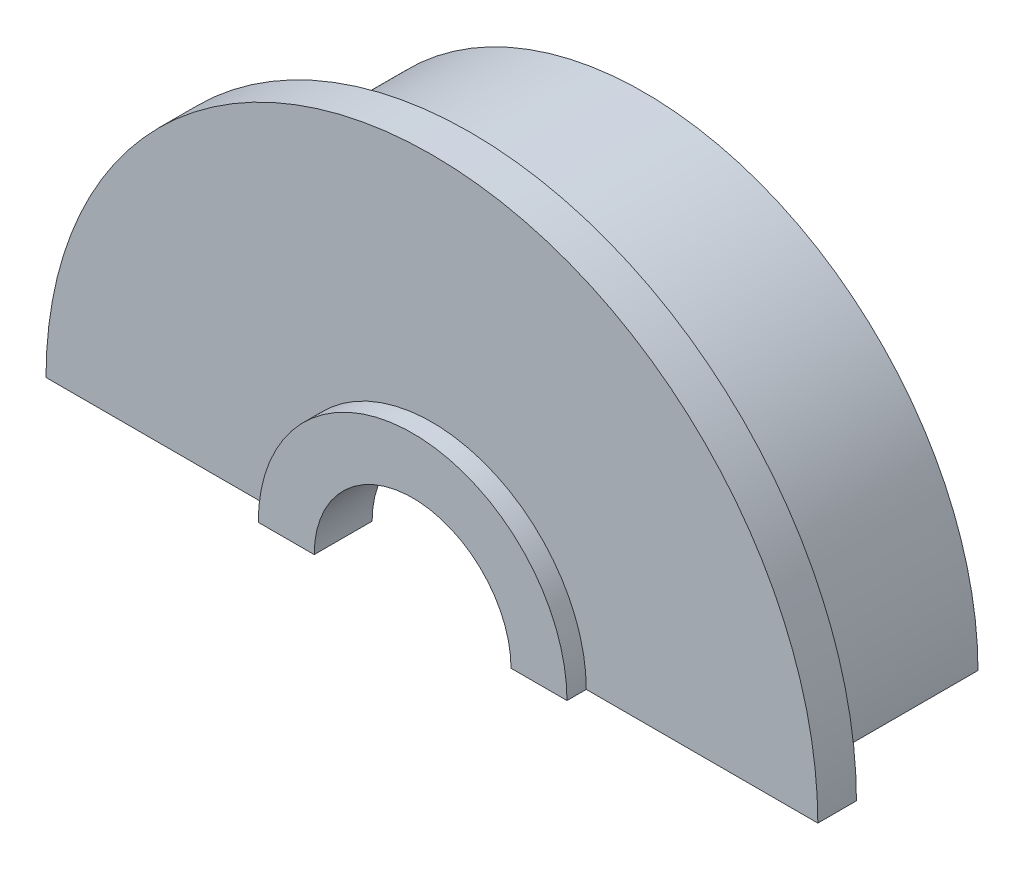
from build123d import *

# Parameters (mm, degrees)
SKETCH1_R               = 17.3
BOSS_EXTRUDE1_DEPTH     = 9
SKETCH2_R               = 5.1
CUT_EXTRUDE1_DEPTH      = 10
SKETCH3_R               = 8.125
CUT_EXTRUDE2_DEPTH      = 9
SKETCH4_R               = 20
SKETCH4_R_2             = 5.1
BOSS_EXTRUDE2_DEPTH     = 2
CUT_EXTRUDE3_DEPTH      = 31.347981811
CUT_EXTRUDE3_DEPTH_BACK = 31.347981811
SKETCH5_W               = 52.021349681
SKETCH5_H               = 22.661429066
BOSS_EXTRUDE3_DEPTH     = 1
SKETCH8_R               = 10.75
CUT_EXTRUDE4_DEPTH      = 3


with BuildPart() as part:
    # Sketch1 → Boss-Extrude1 (new body)
    with BuildSketch(Plane.XY):
        Circle(SKETCH1_R)
    extrude(amount=BOSS_EXTRUDE1_DEPTH)

    # Sketch2 → Cut-Extrude1 (cut)
    with BuildSketch(Plane.XY.offset(9)):
        Circle(SKETCH2_R)
    extrude(amount=-CUT_EXTRUDE1_DEPTH, mode=Mode.SUBTRACT)

    # Sketch3 → Cut-Extrude2 (cut)
    with BuildSketch(Plane(origin=(0, 0, 0), x_dir=(-1, 0, 0), z_dir=(0, 0, -1))):
        Circle(SKETCH3_R)
    extrude(amount=-CUT_EXTRUDE2_DEPTH, mode=Mode.SUBTRACT)

    # Sketch4 → Boss-Extrude2 (add)
    with BuildSketch(Plane.XY.offset(9)):
        Circle(SKETCH4_R)
        Circle(SKETCH4_R_2, mode=Mode.SUBTRACT)
    extrude(amount=BOSS_EXTRUDE2_DEPTH)

    # Sketch5 → Cut-Extrude3 (cut, two sides: drawn at the far end of the back side and taken through both)
    with BuildSketch(Plane(origin=(0, 0, 0), x_dir=(-1, 0, 0), z_dir=(0, 0, -1)).offset(-CUT_EXTRUDE3_DEPTH_BACK)):
        with Locations((0.459170792, -11.330714533)):
            Rectangle(SKETCH5_W, SKETCH5_H)
    extrude(amount=CUT_EXTRUDE3_DEPTH + CUT_EXTRUDE3_DEPTH_BACK, mode=Mode.SUBTRACT)

    # Sketch7 → Boss-Extrude3 (add)
    with BuildSketch(Plane.XY.offset(11)):
        with BuildLine():
            Line((-5.1, 0), (-8, 0))
            ThreePointArc((-8, 0), (0, 8), (8, 0))
            Line((8, 0), (5.1, 0))
            ThreePointArc((5.1, 0), (0, 5.1), (-5.1, 0))
        make_face()
    extrude(amount=BOSS_EXTRUDE3_DEPTH)

    # Sketch8 → Cut-Extrude4 (cut)
    with BuildSketch(Plane(origin=(0, 0, 0), x_dir=(-1, 0, 0), z_dir=(0, 0, -1))):
        Circle(SKETCH8_R)
    extrude(amount=-CUT_EXTRUDE4_DEPTH, mode=Mode.SUBTRACT)


solid = part.part
